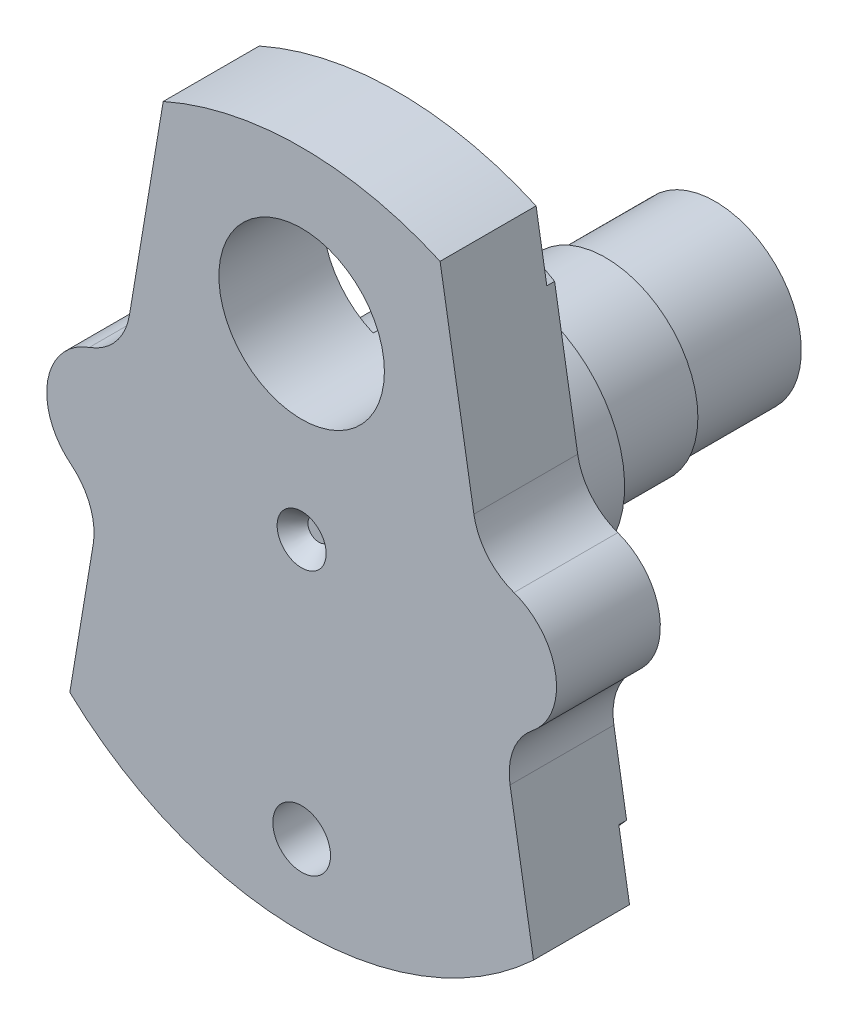
from build123d import *

# Parameters (mm, degrees)
SKETCH1_R           = 14.35
SKETCH1_R_2         = 5
BOSS_EXTRUDE1_DEPTH = 18
SKETCH2_R           = 20
BOSS_EXTRUDE2_DEPTH = 18
SKETCH3_R           = 16
BOSS_EXTRUDE3_DEPTH = 35.7
SKETCH5_OUTSIDE_W   = 123.14
SKETCH5_OUTSIDE_H   = 152.554
SKETCH5_OUTSIDE_R   = 14.935
CUT_EXTRUDE1_DEPTH  = 19
SKETCH7_R           = 4.25
CUT_EXTRUDE3_DEPTH  = 3
CUT_EXTRUDE3_DRAFT  = -38
SKETCH9_OUTSIDE_W   = 123.14
SKETCH9_OUTSIDE_H   = 152.554
SKETCH9_OUTSIDE_R   = 49.923055682
CUT_EXTRUDE4_DEPTH  = 1.35
SKETCH6_R           = 14.35
CUT_EXTRUDE5_DEPTH  = 21.7


with BuildPart() as part:
    # Sketch1 → Boss-Extrude1 (new body)
    with BuildSketch(Plane.XY):
        with BuildLine():
            Line((36.136520686, -18.774478422), (40.195752281, -43.049171521))
            ThreePointArc((40.195752281, -43.049171521), (0, -58.897620241), (-40.195752281, -43.049171521))
            Line((-40.195752281, -43.049171521), (-36.136520686, -18.774478422))
            ThreePointArc((-36.136520686, -18.774478422), (-36.697665198, -13.197066935), (-40.010085223, -8.674868838))
            ThreePointArc((-40.010085223, -8.674868838), (-44.039037615, 1.827589449), (-36.814887741, 10.449987378))
            ThreePointArc((-36.814887741, 10.449987378), (-32.208677837, 13.651878045), (-29.862109135, 18.747257211))
            Line((-29.862109135, 18.747257211), (-24.003146652, 53.784557457))
            ThreePointArc((-24.003146652, 53.784557457), (0, 58.897620241), (24.003146652, 53.784557457))
            Line((24.003146652, 53.784557457), (29.862109135, 18.747257211))
            ThreePointArc((29.862109135, 18.747257211), (32.208677837, 13.651878045), (36.814887741, 10.449987378))
            ThreePointArc((36.814887741, 10.449987378), (44.039037615, 1.827589449), (40.010085223, -8.674868838))
            ThreePointArc((40.010085223, -8.674868838), (36.697665198, -13.197066935), (36.136520686, -18.774478422))
        make_face()
        with Locations((0, 32.4)):
            Circle(SKETCH1_R, mode=Mode.SUBTRACT)
        with Locations((0.004379967, -44.949999787)):
            Circle(SKETCH1_R_2, mode=Mode.SUBTRACT)
    extrude(amount=-BOSS_EXTRUDE1_DEPTH)

    # Sketch2 → Boss-Extrude2 (add)
    with BuildSketch(Plane(origin=(0, 0, -18), x_dir=(-1, 0, 0), z_dir=(0, 0, -1))):
        with Locations(Location((0, 0, 0), (0, 0, 106.311047481))):
            Circle(SKETCH2_R)
    extrude(amount=BOSS_EXTRUDE2_DEPTH)

    # Sketch3 → Boss-Extrude3 (add)
    with BuildSketch(Plane(origin=(0, 0, -36), x_dir=(-1, 0, 0), z_dir=(0, 0, -1))):
        with Locations(Location((0, 0, 0), (0, 0, 180))):
            Circle(SKETCH3_R)
    extrude(amount=BOSS_EXTRUDE3_DEPTH)

    # Sketch5 outside → Cut-Extrude1 (cut)
    with BuildSketch(Plane(origin=(0, 0, -71.7), x_dir=(-1, 0, 0), z_dir=(0, 0, -1))):
        Rectangle(SKETCH5_OUTSIDE_W, SKETCH5_OUTSIDE_H)
        Circle(SKETCH5_OUTSIDE_R, mode=Mode.SUBTRACT)
    extrude(amount=-CUT_EXTRUDE1_DEPTH, mode=Mode.SUBTRACT)


with BuildPart() as cut_extrude3_tool:
    # Sketch7 → Cut-Extrude3 (with draft: the straight prism first)
    with BuildSketch(Plane.XY):
        Circle(SKETCH7_R)
    extrude(amount=-CUT_EXTRUDE3_DEPTH)
    # Cut-Extrude3: the draft: its side faces are tilted about the plane it starts from
    cut_extrude3_sides = [cut_extrude3_tool.faces().sort_by_distance(p)[0] for p in [
        (-4.25, 0, -1.5),
    ]]
    draft(cut_extrude3_sides, Plane.XY, CUT_EXTRUDE3_DRAFT)


with BuildPart() as part_1:
    add(part.part)

    # Cut-Extrude3: cut by cut_extrude3_tool
    add(cut_extrude3_tool.part, mode=Mode.SUBTRACT)

    # Sketch9 outside → Cut-Extrude4 (cut)
    with BuildSketch(Plane(origin=(0, 0, -18), x_dir=(-1, 0, 0), z_dir=(0, 0, -1))):
        Rectangle(SKETCH9_OUTSIDE_W, SKETCH9_OUTSIDE_H)
        Circle(SKETCH9_OUTSIDE_R, mode=Mode.SUBTRACT)
    extrude(amount=-CUT_EXTRUDE4_DEPTH, mode=Mode.SUBTRACT)

    # Sketch6 → Cut-Extrude5 (cut)
    with BuildSketch(Plane.XY):
        with Locations((0, 32.4)):
            Circle(SKETCH6_R)
    extrude(amount=-CUT_EXTRUDE5_DEPTH, mode=Mode.SUBTRACT)


solid = part_1.part
